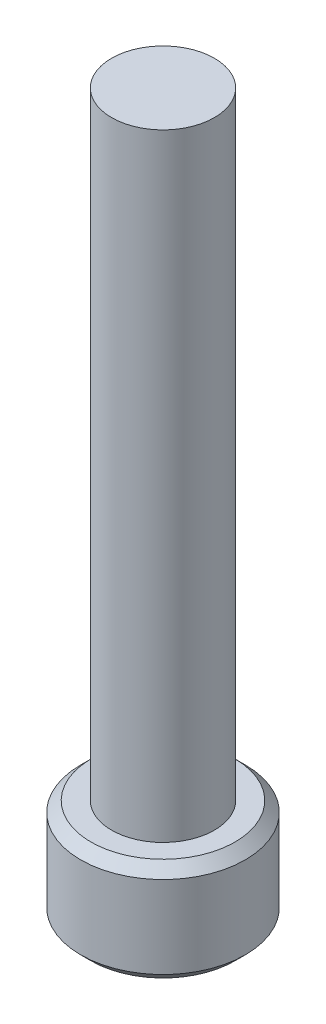
from build123d import *

# Parameters (mm, degrees)
SKETCH1_R           = 2.5
BOSS_EXTRUDE1_DEPTH = 30
SKETCH3_W           = 4
SKETCH3_H           = 5
CUT_EXTRUDE1_START  = -1
CUT_EXTRUDE1_DEPTH  = 30
CHAMFER1_SIZE       = 0.5


with BuildPart() as part:
    # Sketch1 → Boss-Extrude1 (new body)
    with BuildSketch(Plane(origin=(0, 0, 0), x_dir=(1, 0, 0), z_dir=(0, 1, 0))):
        with Locations(Location((0, 0, 0), (0, 0, 270))):
            Circle(SKETCH1_R)
    extrude(amount=BOSS_EXTRUDE1_DEPTH)

    # Sketch3 → Revolve1 (revolve)
    with BuildSketch(Plane.XY, mode=Mode.PRIVATE) as revolve1_sk:
        with Locations((-2, -2.5)):
            Rectangle(SKETCH3_W, SKETCH3_H)
    revolve(revolve1_sk.sketch.rotate(Axis((0, -5, 0), (0, 1, 0)), 270), axis=Axis((0, -5, 0), (0, 1, 0)))

    # Sketch4 → Cut-Extrude1 (cut)
    with BuildSketch(Plane(origin=(0, 0, 0), x_dir=(1, 0, 0), z_dir=(0, 1, 0)).offset(CUT_EXTRUDE1_START)):
        Polygon((2.886751346, 0), (1.443375673, 2.5), (-1.443375673, 2.5), (-2.886751346, 0), (-1.443375673, -2.5), (1.443375673, -2.5), align=None)
    extrude(amount=-CUT_EXTRUDE1_DEPTH, mode=Mode.SUBTRACT)

    # Chamfer1
    chamfer1_edges = [part.edges().sort_by_distance(p)[0] for p in [
        (0, 0, 4),
        (0, -5, 4),
    ]]
    chamfer(chamfer1_edges, length=CHAMFER1_SIZE)


solid = part.part
